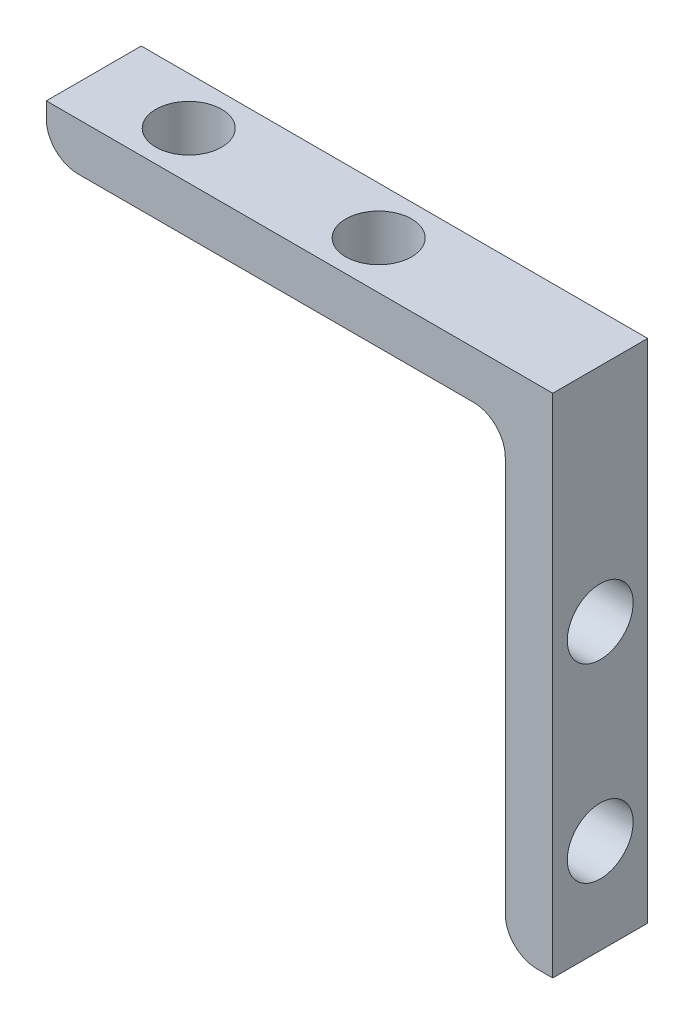
from build123d import *

# Parameters (mm, degrees)
BOSS_EXTRUDE1_DEPTH = 9.525
FILLET1_R           = 3.175
SKETCH2_R           = 3.302
CUT_EXTRUDE1_DEPTH  = 70.215728207
SKETCH3_R           = 3.302
CUT_EXTRUDE2_DEPTH  = 70.215728207


with BuildPart() as part:
    # Sketch1 → Boss-Extrude1 (new body)
    with BuildSketch(Plane.XY):
        Polygon((-50.8, 0), (0, 0), (0, -50.8), (-4.7625, -50.8), (-4.7625, -4.7625), (-50.8, -4.7625), align=None)
    extrude(amount=BOSS_EXTRUDE1_DEPTH)

    # Fillet1
    fillet1_edges = [part.edges().sort_by_distance(p)[0] for p in [
        (-4.7625, -50.8, 4.7625),
        (-4.7625, -4.7625, 4.7625),
        (-50.8, -4.7625, 4.7625),
    ]]
    fillet(fillet1_edges, radius=FILLET1_R)

    # Sketch2 → Cut-Extrude1 (cut, through all)
    with BuildSketch(Plane.ZY.offset(4.7625)):
        with Locations(Location((4.7625, -41.275, 0), (0, 0, 270))):
            Circle(SKETCH2_R)
        with Locations(Location((4.7625, -22.225, 0), (0, 0, 270))):
            Circle(SKETCH2_R)
    extrude(amount=-CUT_EXTRUDE1_DEPTH, mode=Mode.SUBTRACT)

    # Sketch3 → Cut-Extrude2 (cut, through all)
    with BuildSketch(Plane.XZ.offset(4.7625)):
        with Locations((-41.275, 4.7625)):
            Circle(SKETCH3_R)
        with Locations((-22.225, 4.7625)):
            Circle(SKETCH3_R)
    extrude(amount=-CUT_EXTRUDE2_DEPTH, mode=Mode.SUBTRACT)


solid = part.part
